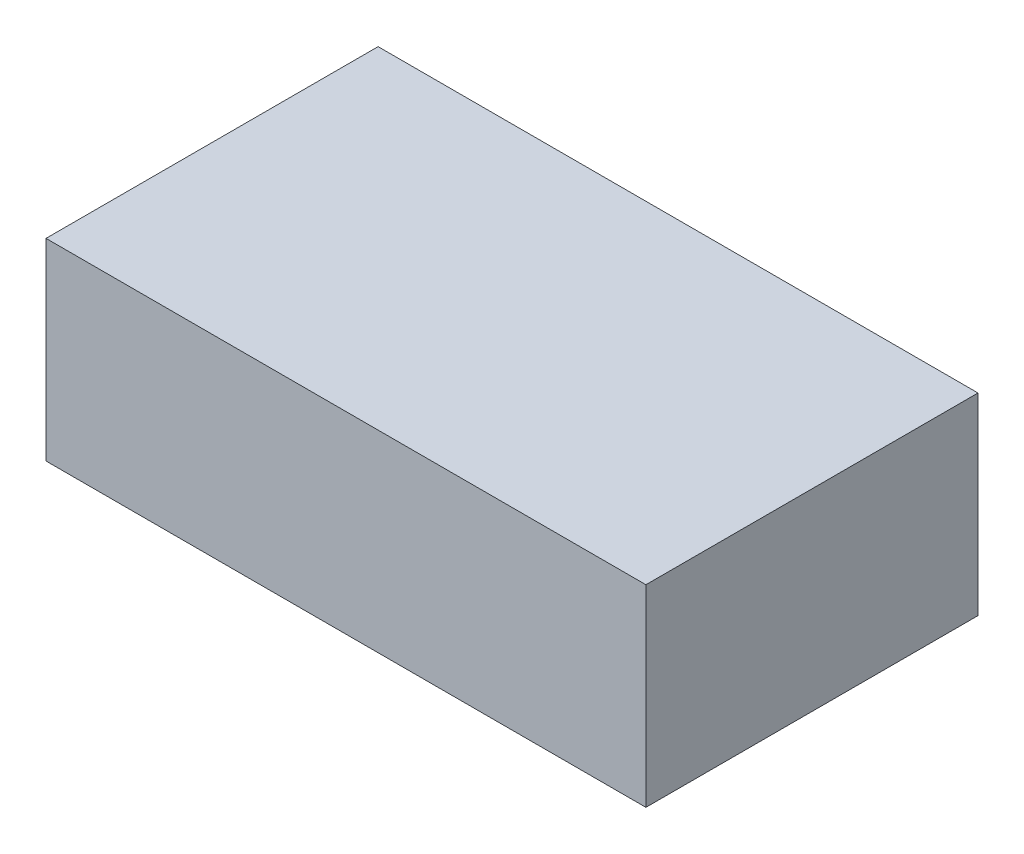
from build123d import *

# Parameters (mm, degrees)
SKETCH1_W           = 56
SKETCH1_H           = 31
BOSS_EXTRUDE1_DEPTH = 18


with BuildPart() as part:
    # Sketch1 → Boss-Extrude1 (new body)
    with BuildSketch(Plane(origin=(0, 0, 0), x_dir=(1, 0, 0), z_dir=(0, 1, 0))):
        with Locations((28, 16.015151515)):
            Rectangle(SKETCH1_W, SKETCH1_H)
    extrude(amount=BOSS_EXTRUDE1_DEPTH)


solid = part.part
